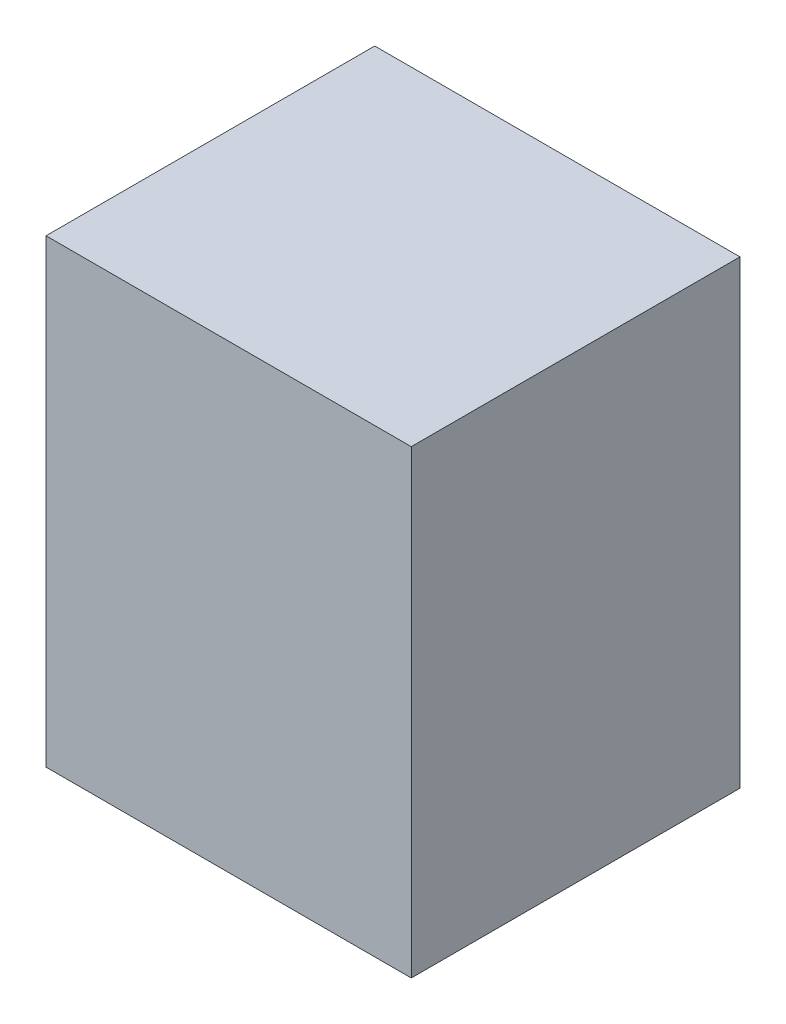
from build123d import *

# Parameters (mm, degrees)
SKETCH1_W           = 10
SKETCH1_H           = 12.6
BOSS_EXTRUDE1_DEPTH = 9


with BuildPart() as part:
    # Sketch1 → Boss-Extrude1 (new body)
    with BuildSketch(Plane.XY):
        with Locations((5, 6.3)):
            Rectangle(SKETCH1_W, SKETCH1_H)
    extrude(amount=BOSS_EXTRUDE1_DEPTH)


solid = part.part
